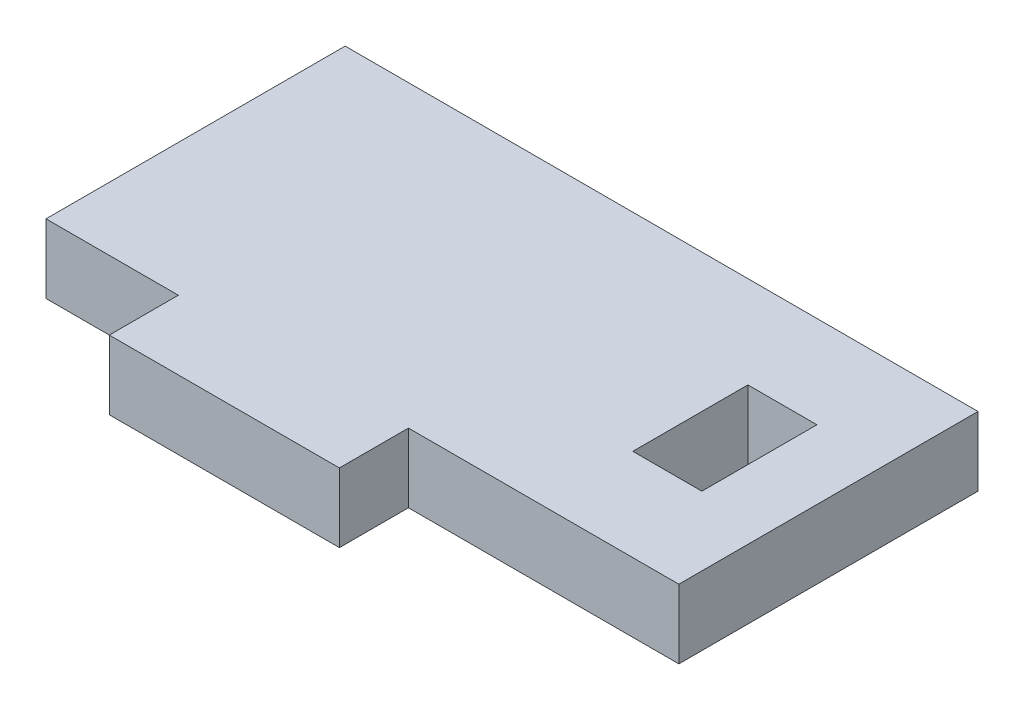
from build123d import *

# Parameters (mm, degrees)
SKETCH1_W           = 3
SKETCH1_H           = 5
BOSS_EXTRUDE1_DEPTH = 3


with BuildPart() as part:
    # Sketch1 → Boss-Extrude1 (new body)
    with BuildSketch(Plane(origin=(0, 0, 0), x_dir=(1, 0, 0), z_dir=(0, 1, 0))):
        Polygon((-21.75, 0), (-21.75, -3), (-11.75, -3), (-11.75, 0), (0, 0), (0, 13), (-27.5, 13), (-27.5, 0), align=None)
        with Locations((-4.5, 6.5)):
            Rectangle(SKETCH1_W, SKETCH1_H, mode=Mode.SUBTRACT)
    extrude(amount=BOSS_EXTRUDE1_DEPTH)


solid = part.part
